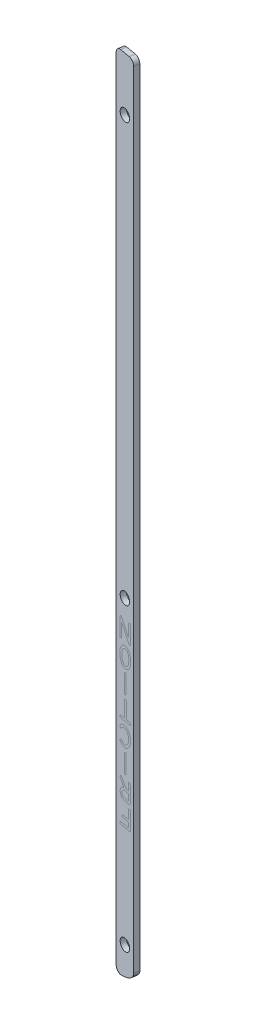
from build123d import *

# Parameters (mm, degrees)
SKETCH1_W             = 6.35
SKETCH1_H             = 237.248411897
BOSS_EXTRUDE1_DEPTH   = 1.5875
CUT_EXTRUDE1_DEPTH    = 217.487166027
FILLET1_R             = 1.5875
F_4_CLEARANCE_HOLE1_D = 3.4544


with BuildPart() as part:
    # Sketch1 → Boss-Extrude1 (new body)
    with BuildSketch(Plane(origin=(23.448725568, 0, -121.072657859), x_dir=(0.9848077530122085, 0, 0.17364817766692836), z_dir=(-0.17364817766692836, 0, 0.9848077530122085))):
        with Locations((-156.347723262, 29.663605247)):
            Rectangle(SKETCH1_W, SKETCH1_H)
    extrude(amount=BOSS_EXTRUDE1_DEPTH)

    # Sketch5 → Cut-Extrude1 (cut, through all)
    with BuildSketch(Plane(origin=(21.411709489, 0, -121.431838754), x_dir=(-0.9848077530122086, 0, -0.1736481776669278), z_dir=(0.17364817766692778, 0, -0.9848077530122085))):
        with BuildLine():
            Line((157.454282927, -88.960600702), (151.104282926, -88.960600702))
            Line((151.104282926, -88.960600702), (151.104282926, -85.785600702))
            add(Edge.make_bspline(
                [(157.454282927, -88.960600702), (156.478833721, -88.960600702), (155.547731492, -88.814113606), (154.541218358, -88.655762372), (153.69021453, -88.342663916), (152.667745865, -87.966480695), (152.012488578, -87.421859718), (151.604733254, -87.082951464), (151.375343959, -86.703342636), (151.104282926, -86.254772615), (151.104282926, -85.785600702)],
                knots=[0, 0, 0, 0.25, 0.25, 0.5, 0.5, 0.75, 0.75, 0.875, 0.875, 1, 1, 1], degree=2))
        make_face()
    extrude(amount=-CUT_EXTRUDE1_DEPTH, mode=Mode.SUBTRACT)

    # Fillet1
    fillet1_edges = [part.edges().sort_by_distance(p)[0] for p in [
        (-127.534793091, 148.287811195, -146.889130968),
        (-133.788322323, 148.287811195, -147.991796896),
        (-133.788322323, -88.960600702, -147.991796896),
    ]]
    fillet(fillet1_edges, radius=FILLET1_R)

    # #4 Clearance Hole1 (through all)
    with Locations(Plane(origin=(21.136043007, 0, -119.868456446), x_dir=(0.9848077530122086, 0, 0.1736481776669278), z_dir=(-0.17364817766692778, 0, 0.9848077530122085))):
        with Locations((-154.279282926, 8.587811195), (-154.279282926, -80.273715104), (-154.279282926, 132.412811195)):
            Hole(F_4_CLEARANCE_HOLE1_D / 2)


solid = part.part
